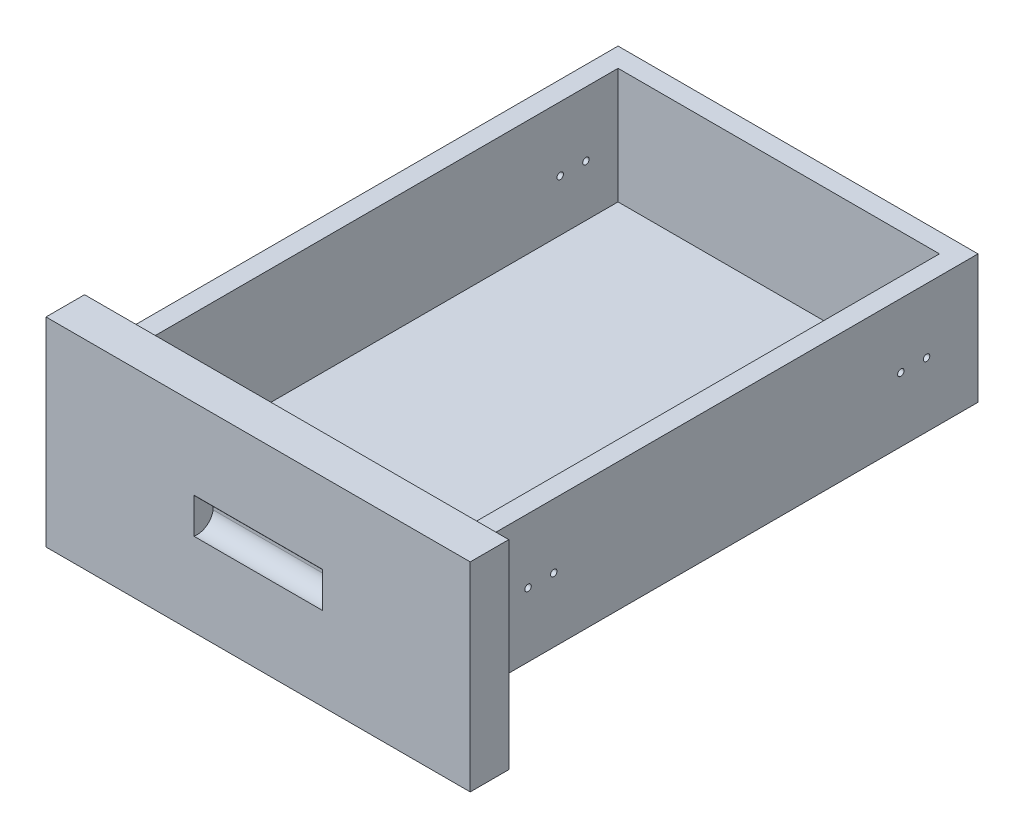
from build123d import *

# Parameters (mm, degrees)
SKETCH1_W           = 330
SKETCH1_H           = 155
BOSS_EXTRUDE1_DEPTH = 30
SKETCH2_W           = 280
SKETCH2_H           = 100
BOSS_EXTRUDE2_DEPTH = 390
SKETCH3_W           = 250
SKETCH3_H           = 375
CUT_EXTRUDE1_DEPTH  = 90
CUT_EXTRUDE2_DEPTH  = 50
FILLET1_R           = 0.5
SKETCH7_R           = 2.5
CUT_EXTRUDE3_DEPTH  = 502.129973161


with BuildPart() as part:
    # Sketch1 → Boss-Extrude1 (new body)
    with BuildSketch(Plane.XY):
        Rectangle(SKETCH1_W, SKETCH1_H)
    extrude(amount=BOSS_EXTRUDE1_DEPTH)

    # Sketch2 → Boss-Extrude2 (add)
    with BuildSketch(Plane(origin=(0, 0, 0), x_dir=(-1, 0, 0), z_dir=(0, 0, -1))):
        with Locations((0, 12.5)):
            Rectangle(SKETCH2_W, SKETCH2_H)
    extrude(amount=BOSS_EXTRUDE2_DEPTH)

    # Sketch3 → Cut-Extrude1 (cut)
    with BuildSketch(Plane(origin=(0, 62.5, 0), x_dir=(1, 0, 0), z_dir=(0, 1, 0))):
        with Locations((0, 187.5)):
            Rectangle(SKETCH3_W, SKETCH3_H)
    extrude(amount=-CUT_EXTRUDE1_DEPTH, mode=Mode.SUBTRACT)

    # Sketch4 → Cut-Extrude2 (cut, symmetric)
    with BuildSketch(Plane(origin=(0, 0, 0), x_dir=(0, 0, -1), z_dir=(1, 0, 0))):
        with BuildLine():
            Line((-35.714873599, 8.791050276), (-23.35130712, 19.957391338))
            ThreePointArc((-23.35130712, 19.957391338), (-17.969795035, 20.816040293), (-15, 16.246765975))
            Line((-15, 16.246765975), (-15, -2.5))
            ThreePointArc((-15, -2.5), (-33.319001977, -11.460982872), (-35.714873599, 8.791050276))
        make_face()
    extrude(amount=CUT_EXTRUDE2_DEPTH, both=True, mode=Mode.SUBTRACT)

    # Fillet1
    fillet1_edges = [part.edges().sort_by_distance(p)[0] for p in [
        (0, 13.952524341, 30),
    ]]
    fillet(fillet1_edges, radius=FILLET1_R)

    # Sketch7 → Cut-Extrude3 (cut, through all)
    with BuildSketch(Plane(origin=(140, 0, 0), x_dir=(0, 0, -1), z_dir=(1, 0, 0))):
        with Locations((350, 12.5)):
            Circle(SKETCH7_R)
        with Locations((330, 12.5)):
            Circle(SKETCH7_R)
        with Locations((60, 12.5)):
            Circle(SKETCH7_R)
        with Locations((40, 12.5)):
            Circle(SKETCH7_R)
    extrude(amount=-CUT_EXTRUDE3_DEPTH, mode=Mode.SUBTRACT)


solid = part.part
